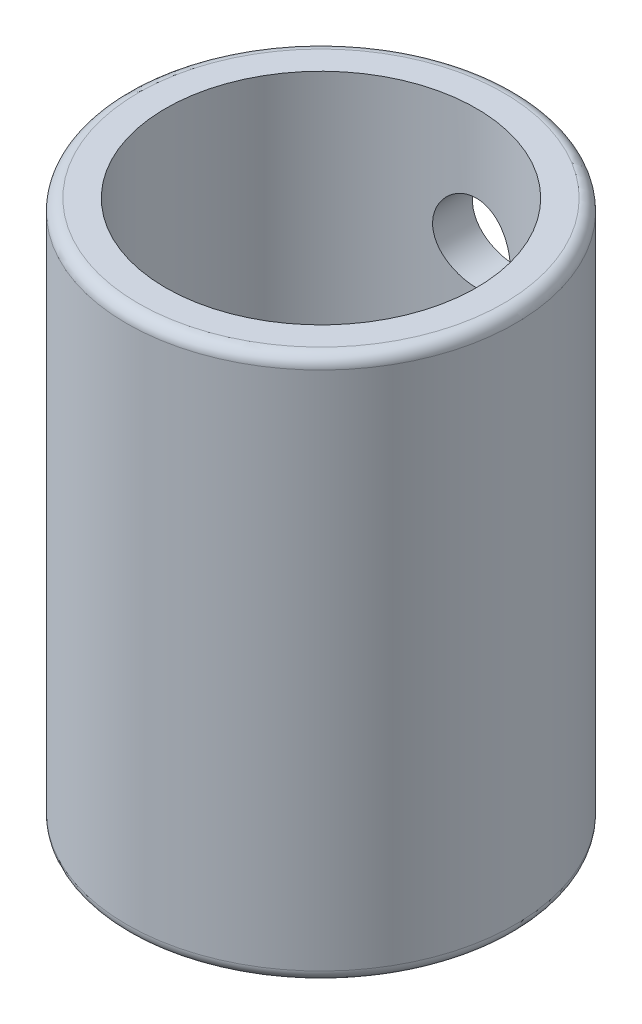
from build123d import *

# Parameters (mm, degrees)
SKETCH_1_R          = 5
SKETCH_1_R_2        = 2.5
EXTRUDE_1_DEPTH     = 7
SKETCH_2_R          = 5
SKETCH_2_R_2        = 4
EXTRUDE_2_DEPTH     = 7
FILLET_1_R          = 0.3
SKETCH_3_R          = 1
CUT_EXTRUDE_1_DEPTH = 7


with BuildPart() as part:
    # 草图1 → 凸台-拉伸1 (new body)
    with BuildSketch(Plane(origin=(0, 0, 0), x_dir=(1, 0, 0), z_dir=(0, 1, 0))):
        with Locations(Location((0, 0, 0), (0, 0, 270))):
            Circle(SKETCH_1_R)
        with Locations(Location((0, 0, 0), (0, 0, 270))):
            Circle(SKETCH_1_R_2, mode=Mode.SUBTRACT)
    extrude(amount=EXTRUDE_1_DEPTH)

    # 草图2 → 凸台-拉伸2 (add)
    with BuildSketch(Plane(origin=(0, 7, 0), x_dir=(1, 0, 0), z_dir=(0, 1, 0))):
        with Locations(Location((0, 0, 0), (0, 0, 270))):
            Circle(SKETCH_2_R)
        with Locations(Location((0, 0, 0), (0, 0, 270))):
            Circle(SKETCH_2_R_2, mode=Mode.SUBTRACT)
    extrude(amount=EXTRUDE_2_DEPTH)

    # 圆角1
    fillet_1_edges = [part.edges().sort_by_distance(p)[0] for p in [
        (0, 14, -5),
        (0, 0, -5),
    ]]
    fillet(fillet_1_edges, radius=FILLET_1_R)

    # 草图3 → 切除-拉伸1 (cut)
    with BuildSketch(Plane.XY):
        with Locations(Location((0, 11, 0), (0, 0, 90))):
            Circle(SKETCH_3_R)
        with Locations(Location((0, 3, 0), (0, 0, 90))):
            Circle(SKETCH_3_R)
    extrude(amount=-CUT_EXTRUDE_1_DEPTH, mode=Mode.SUBTRACT)


solid = part.part
